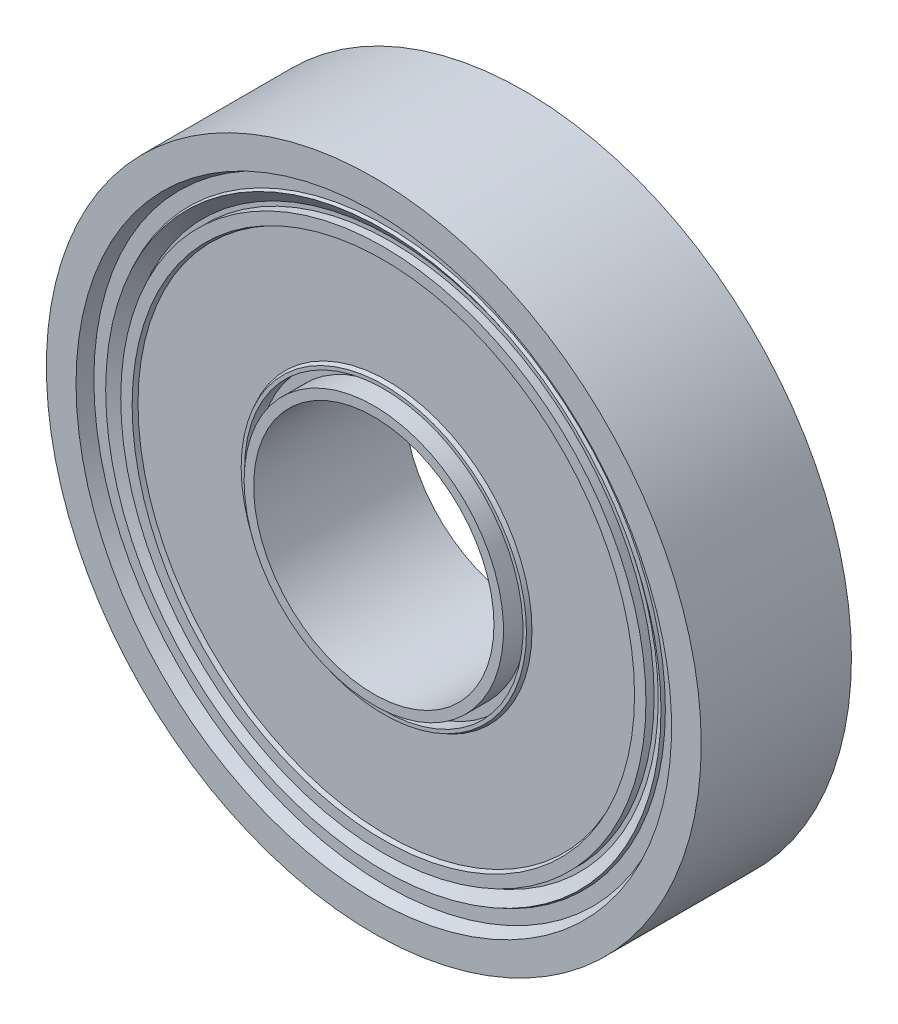
from build123d import *

# Parameters (mm, degrees)
SKETCH1_R           = 10.9
SKETCH1_R_2         = 4
BOSS_EXTRUDE1_DEPTH = 5


with BuildPart() as part:
    # Sketch1 → Boss-Extrude1 (new body)
    with BuildSketch(Plane.XY):
        Circle(SKETCH1_R)
        Circle(SKETCH1_R_2, mode=Mode.SUBTRACT)
    extrude(amount=BOSS_EXTRUDE1_DEPTH)

    # Sketch2 → Cut-Revolve1 (revolve, cut)
    with BuildSketch(Plane(origin=(0, 0, 0), x_dir=(1, 0, 0), z_dir=(0, 1, 0))):
        Polygon((-10.9, -5), (-9.912939245, -5), (-9.732966379, -4.586942685), (-9.293313352, -4.586942685), (-9.243161822, -4.682862035), (-8.878748767, -4.409552244), (-8.742093871, -4.409552244), (-8.742093871, -4.682862035), (-8.362496939, -4.682862035), (-8.302955146, -4.546207139), (-4.812245389, -4.546207139), (-4.748734143, -4.667678158), (-4.635669369, -4.667678158), (-4.635669369, -4.21672133), (-4.317834685, -4.21672133), (-4.317834685, -5), (-6.380746686, -5.704606556), (-10.9, -5.809210272), align=None)
        Polygon((-6.380746686, 0.704606556), (-4.317834685, 0), (-4.317834685, -0.78327867), (-4.635669369, -0.78327867), (-4.635669369, -0.332321842), (-4.748734143, -0.332321842), (-4.812245389, -0.453792861), (-8.302955146, -0.453792861), (-8.362496939, -0.317137965), (-8.742093871, -0.317137965), (-8.742093871, -0.590447756), (-8.878748767, -0.590447756), (-9.243161822, -0.317137965), (-9.293313352, -0.413057315), (-9.732966379, -0.413057315), (-9.912939245, 0), (-10.9, 0), (-10.9, 0.809210272), align=None)
    revolve(axis=Axis((0, 0, 0), (0, 0, 1)), mode=Mode.SUBTRACT)


solid = part.part
